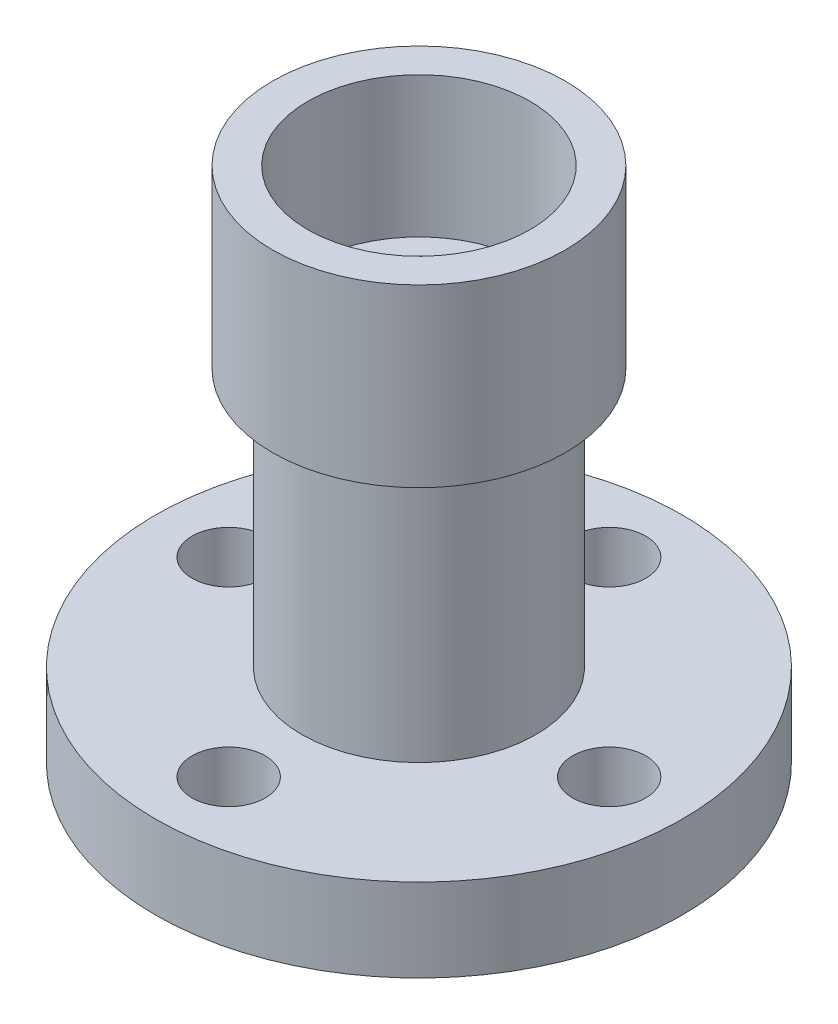
from build123d import *

# Parameters (mm, degrees)
CROQUIS2_R              = 45
SALIENTE_EXTRUIR1_DEPTH = 14.2
CROQUIS3_R              = 20
SALIENTE_EXTRUIR3_DEPTH = 77.4
CROQUIS7_R              = 25
SALIENTE_EXTRUIR5_DEPTH = 30
CROQUIS13_R             = 15
CORTAR_EXTRUIR4_DEPTH   = 64.4
CHAFL_N1_SIZE           = 3
CHAFL_N1_SIZE2          = 3.5
CROQUIS14_R             = 19
CORTAR_EXTRUIR5_DEPTH   = 24
CROQUIS15_R             = 6.25
CORTAR_EXTRUIR6_DEPTH   = 14.2


with BuildPart() as part:
    # Croquis2 → Saliente-Extruir1 (new body)
    with BuildSketch(Plane(origin=(0, 0, 0), x_dir=(1, 0, 0), z_dir=(0, 1, 0))):
        with Locations(Location((0, 0, 0), (0, 0, 270))):
            Circle(CROQUIS2_R)
    extrude(amount=SALIENTE_EXTRUIR1_DEPTH)

    # Croquis3 → Saliente-Extruir3 (add)
    with BuildSketch(Plane(origin=(0, 0, 0), x_dir=(1, 0, 0), z_dir=(0, 1, 0))):
        with Locations(Location((0, 0, 0), (0, 0, 270))):
            Circle(CROQUIS3_R)
    extrude(amount=SALIENTE_EXTRUIR3_DEPTH)

    # Croquis7 → Saliente-Extruir5 (add)
    with BuildSketch(Plane(origin=(0, 58.4, 0), x_dir=(1, 0, 0), z_dir=(0, 1, 0))):
        with Locations(Location((0, 0, 0), (0, 0, 270))):
            Circle(CROQUIS7_R)
    extrude(amount=SALIENTE_EXTRUIR5_DEPTH)

    # Croquis13 → Cortar-Extruir4 (cut)
    with BuildSketch(Plane(origin=(0, 0, 0), x_dir=(1, 0, 0), z_dir=(0, 1, 0))):
        with Locations(Location((0, 0, 0), (0, 0, 270))):
            Circle(CROQUIS13_R)
    extrude(amount=CORTAR_EXTRUIR4_DEPTH, mode=Mode.SUBTRACT)

    # Chaflán1
    chafl_n1_edges = [part.edges().sort_by_distance(p)[0] for p in [
        (0, 0, -15),
    ]]
    chafl_n1_side = [part.faces().sort_by_distance(p)[0] for p in [
        (0, 32.2, -15),
    ]]
    chamfer(chafl_n1_edges, length=CHAFL_N1_SIZE, length2=CHAFL_N1_SIZE2, reference=chafl_n1_side[0])

    # Croquis14 → Cortar-Extruir5 (cut)
    with BuildSketch(Plane(origin=(0, 88.4, 0), x_dir=(1, 0, 0), z_dir=(0, 1, 0))):
        with Locations(Location((0, 0, 0), (0, 0, 270))):
            Circle(CROQUIS14_R)
    extrude(amount=-CORTAR_EXTRUIR5_DEPTH, mode=Mode.SUBTRACT)

    # Croquis15 → Cortar-Extruir6 (cut)
    with BuildSketch(Plane(origin=(0, 14.2, 0), x_dir=(1, 0, 0), z_dir=(0, 1, 0))):
        with Locations(Location((0, -32.5, 0), (0, 0, 270))):
            Circle(CROQUIS15_R)
        with Locations(Location((-32.5, 0, 0), (0, 0, 270))):
            Circle(CROQUIS15_R)
        with Locations(Location((0, 32.5, 0), (0, 0, 270))):
            Circle(CROQUIS15_R)
        with Locations(Location((32.5, 0, 0), (0, 0, 270))):
            Circle(CROQUIS15_R)
    extrude(amount=-CORTAR_EXTRUIR6_DEPTH, mode=Mode.SUBTRACT)


solid = part.part
